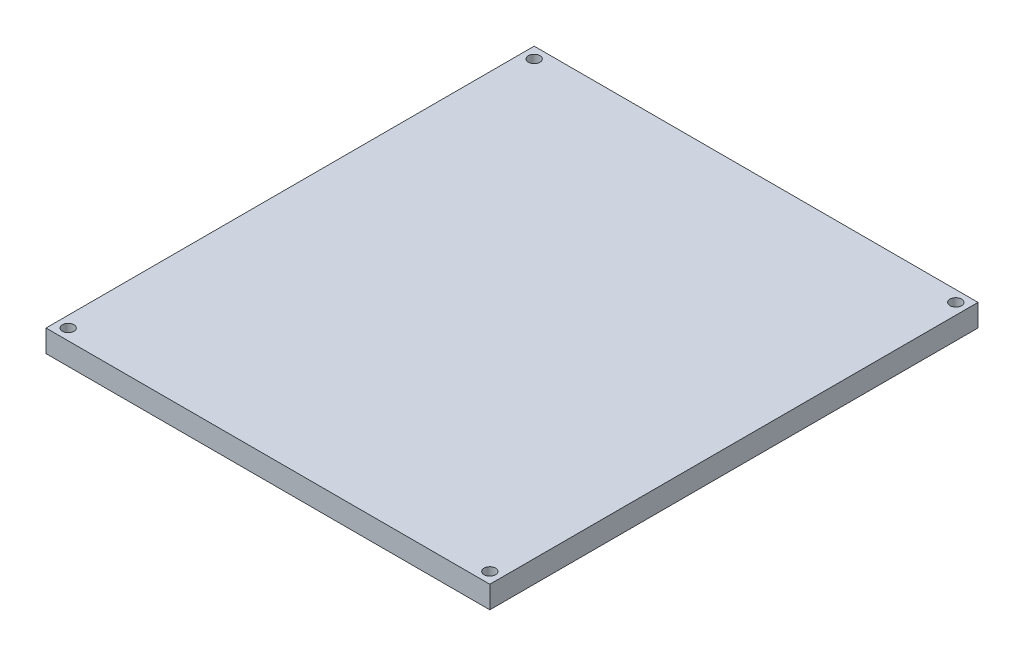
from build123d import *

# Parameters (mm, degrees)
SKETCH1_W           = 127
SKETCH1_H           = 139.7
BOSS_EXTRUDE1_DEPTH = 6.35
SKETCH3_R           = 1.65
CUT_EXTRUDE1_DEPTH  = 95.612869104


with BuildPart() as part:
    # Sketch1 → Boss-Extrude1 (new body)
    with BuildSketch(Plane(origin=(0, 0, 0), x_dir=(1, 0, 0), z_dir=(0, 1, 0))):
        Rectangle(SKETCH1_W, SKETCH1_H)
    extrude(amount=BOSS_EXTRUDE1_DEPTH)

    # Sketch3 → Cut-Extrude1 (cut, through all)
    with BuildSketch(Plane(origin=(0, 6.35, 0), x_dir=(1, 0, 0), z_dir=(0, 1, 0))):
        with Locations(Location((60.325, 66.675, 0), (0, 0, 270))):
            Circle(SKETCH3_R)
        with Locations(Location((60.325, -66.675, 0), (0, 0, 270))):
            Circle(SKETCH3_R)
        with Locations(Location((-60.325, -66.675, 0), (0, 0, 270))):
            Circle(SKETCH3_R)
        with Locations(Location((-60.325, 66.675, 0), (0, 0, 270))):
            Circle(SKETCH3_R)
    extrude(amount=-CUT_EXTRUDE1_DEPTH, mode=Mode.SUBTRACT)


solid = part.part
